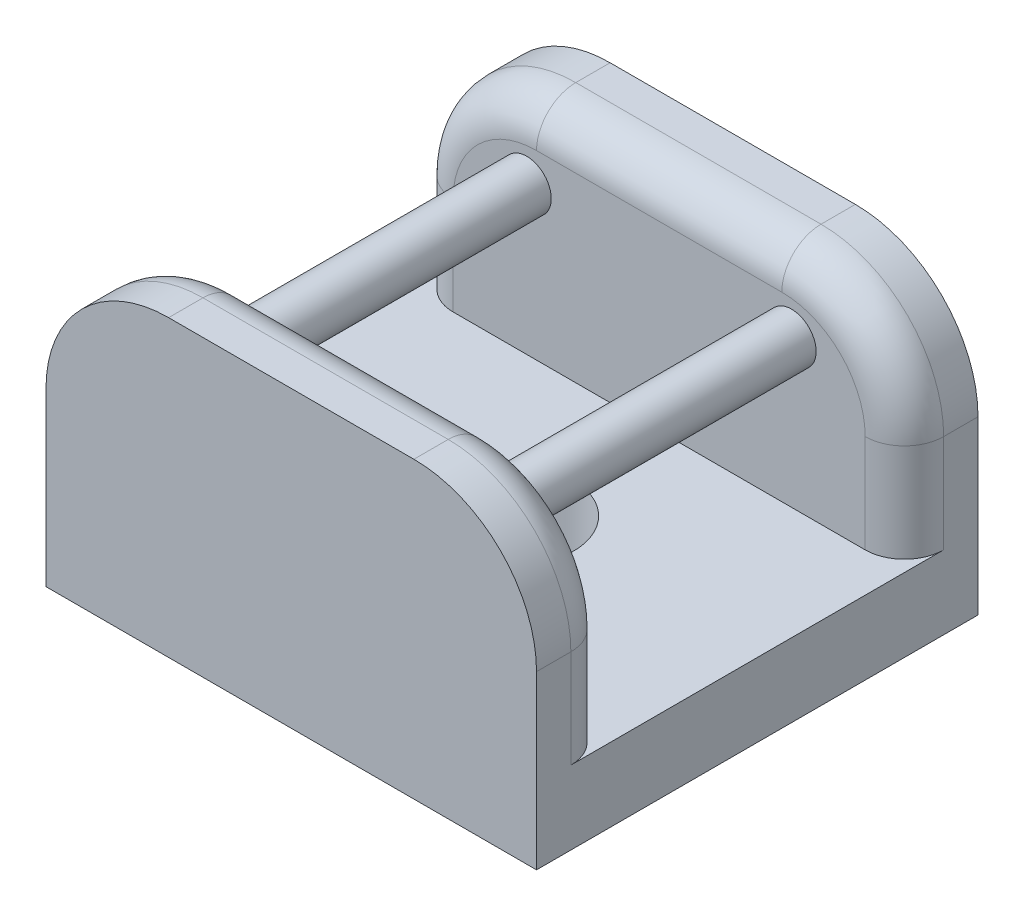
from build123d import *

# Parameters (mm, degrees)
BOSS_EXTRUDE1_DEPTH = 100
SKETCH2_R           = 5
BOSS_EXTRUDE2_DEPTH = 60
SKETCH3_R           = 12.5
CUT_EXTRUDE1_DEPTH  = 148.309198627
CUT_EXTRUDE2_DEPTH  = 148.309198627
FILLET1_R           = 8


with BuildPart() as part:
    # Sketch1 → Boss-Extrude1 (new body)
    with BuildSketch(Plane(origin=(0, 0, 0), x_dir=(0, 0, -1), z_dir=(1, 0, 0))):
        Polygon((0, 0), (0, 60), (15, 60), (15, 15), (75, 15), (75, 60), (90, 60), (90, 0), align=None)
    extrude(amount=BOSS_EXTRUDE1_DEPTH)

    # Sketch2 → Boss-Extrude2 (add)
    with BuildSketch(Plane(origin=(0, 0, -15), x_dir=(-1, 0, 0), z_dir=(0, 0, -1))):
        with Locations(Location((-77, 45, 0), (0, 0, 270))):
            Circle(SKETCH2_R)
        with Locations(Location((-23, 45, 0), (0, 0, 270))):
            Circle(SKETCH2_R)
    extrude(amount=BOSS_EXTRUDE2_DEPTH)

    # Sketch3 → Cut-Extrude1 (cut, through all)
    with BuildSketch(Plane.XZ):
        with Locations(Location((50, -45, 0), (0, 0, 270))):
            Circle(SKETCH3_R)
    extrude(amount=-CUT_EXTRUDE1_DEPTH, mode=Mode.SUBTRACT)

    # Sketch4 → Cut-Extrude2 (cut, through all)
    with BuildSketch(Plane(origin=(0, 0, -90), x_dir=(-1, 0, 0), z_dir=(0, 0, -1))):
        with BuildLine():
            ThreePointArc((-100, 35), (-92.67766953, 52.67766953), (-75, 60))
            Line((-75, 60), (-100, 60))
            Line((-100, 60), (-100, 35))
        make_face()
        with BuildLine():
            ThreePointArc((-25, 60), (-7.32233047, 52.67766953), (0, 35))
            Line((0, 35), (0, 60))
            Line((0, 60), (-25, 60))
        make_face()
    extrude(amount=-CUT_EXTRUDE2_DEPTH, mode=Mode.SUBTRACT)

    # Fillet1
    fillet1_edges = [part.edges().sort_by_distance(p)[0] for p in [
        (100, 25, -15),
        (0, 25, -75),
        (100, 25, -75),
        (50, 60, -15),
        (50, 60, -75),
        (92.67766953, 52.67766953, -75),
        (92.67766953, 52.67766953, -15),
        (7.32233047, 52.67766953, -75),
        (7.32233047, 52.67766953, -15),
        (0, 25, -15),
    ]]
    fillet(fillet1_edges, radius=FILLET1_R)


solid = part.part
